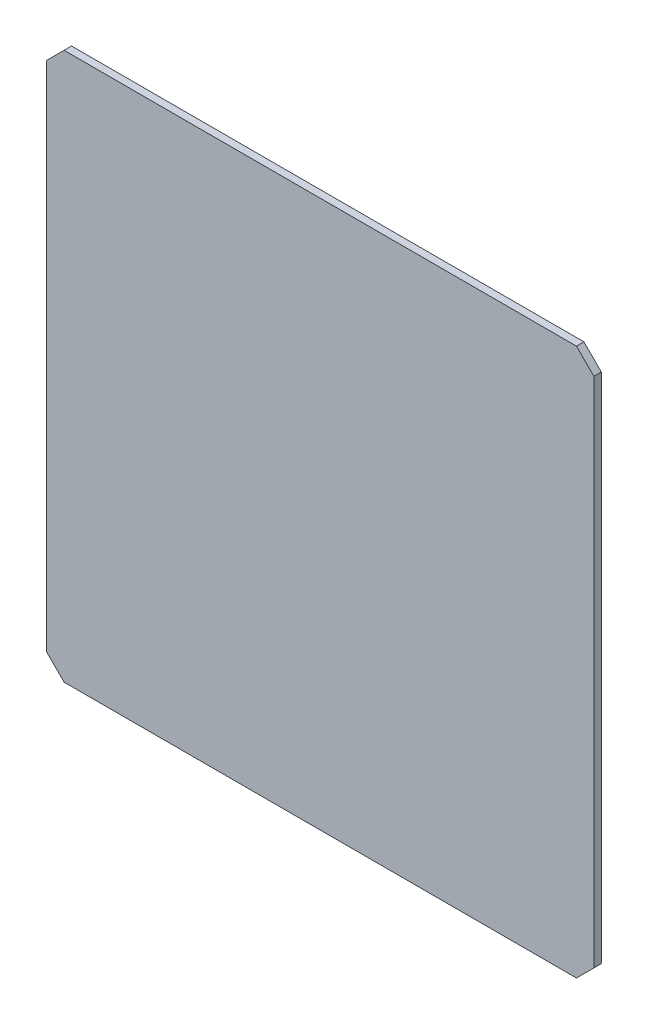
from build123d import *

# Parameters (mm, degrees)
SKETCH1_W           = 220
SKETCH1_H           = 220
BOSS_EXTRUDE1_DEPTH = 3
CHAMFER1_SIZE       = 7


with BuildPart() as part:
    # Sketch1 → Boss-Extrude1 (new body)
    with BuildSketch(Plane.XY):
        with Locations((110, 110)):
            Rectangle(SKETCH1_W, SKETCH1_H)
    extrude(amount=-BOSS_EXTRUDE1_DEPTH)

    # Chamfer1
    chamfer1_edges = [part.edges().sort_by_distance(p)[0] for p in [
        (0, 220, -1.5),
        (220, 220, -1.5),
        (220, 0, -1.5),
        (0, 0, -1.5),
    ]]
    chamfer(chamfer1_edges, length=CHAMFER1_SIZE)


solid = part.part
